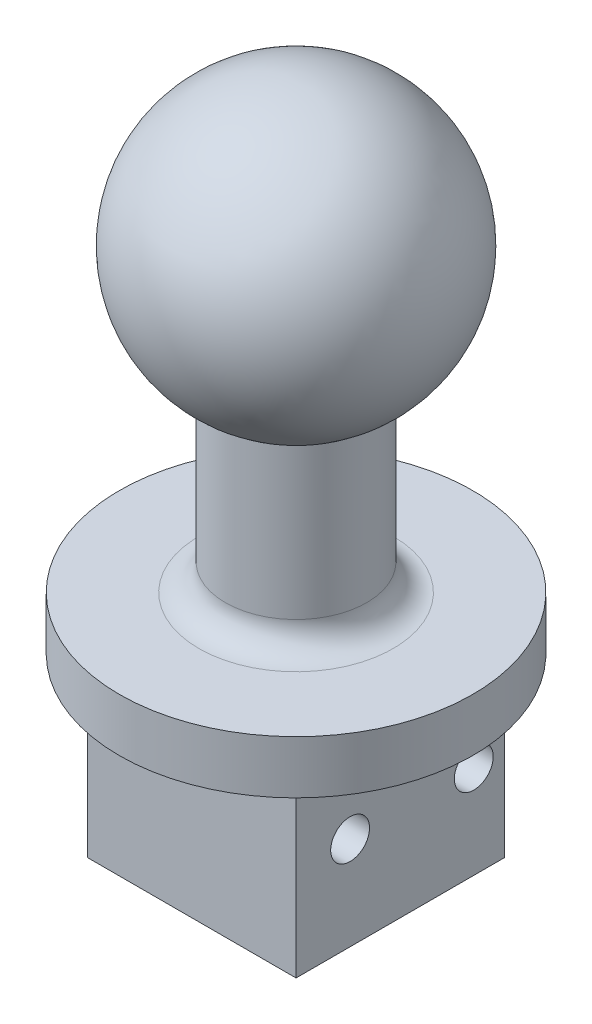
from build123d import *

# Parameters (mm, degrees)
SKETCH1_W           = 11.8
SKETCH1_H           = 11.8
BOSS_EXTRUDE1_DEPTH = 10
SKETCH2_R           = 10
BOSS_EXTRUDE2_DEPTH = 3
SKETCH3_R           = 4
BOSS_EXTRUDE3_DEPTH = 15
FILLET1_R           = 0.5
FILLET2_R           = 1.5
CUT_EXTRUDE1_REACH  = 44.389
SKETCH6_R           = 1.1


with BuildPart() as part:
    # Sketch1 → Boss-Extrude1 (new body)
    with BuildSketch(Plane(origin=(0, 0, 0), x_dir=(1, 0, 0), z_dir=(0, 1, 0))):
        Rectangle(SKETCH1_W, SKETCH1_H)
    extrude(amount=BOSS_EXTRUDE1_DEPTH)

    # Sketch2 → Boss-Extrude2 (add)
    with BuildSketch(Plane(origin=(0, 10, 0), x_dir=(1, 0, 0), z_dir=(0, 1, 0))):
        with Locations(Location((0, 0, 0), (0, 0, 270))):
            Circle(SKETCH2_R)
    extrude(amount=BOSS_EXTRUDE2_DEPTH)

    # Sketch3 → Boss-Extrude3 (add)
    with BuildSketch(Plane(origin=(0, 13, 0), x_dir=(1, 0, 0), z_dir=(0, 1, 0))):
        with Locations(Location((0, 0, 0), (0, 0, 270))):
            Circle(SKETCH3_R)
    extrude(amount=BOSS_EXTRUDE3_DEPTH)

    # Sketch4 → Revolve1 (revolve)
    with BuildSketch(Plane.XY):
        with BuildLine():
            Line((0, 38), (0, 22))
            ThreePointArc((0, 22), (8, 30), (0, 38))
        make_face()
    revolve(axis=Axis((0, 0, 0), (0, 1, 0)))

    # Fillet1
    fillet1_edges = [part.edges().sort_by_distance(p)[0] for p in [
        (-5.9, 10, 0),
        (0, 10, 5.9),
        (5.9, 10, 0),
        (0, 10, -5.9),
    ]]
    fillet(fillet1_edges, radius=FILLET1_R)

    # Fillet2
    fillet2_edges = [part.edges().sort_by_distance(p)[0] for p in [
        (0, 13, -4),
    ]]
    fillet(fillet2_edges, radius=FILLET2_R)

    # Sketch6 → Cut-Extrude1 (cut, up to next)
    with BuildSketch(Plane(origin=(5.9, 0, 0), x_dir=(0, 0, -1), z_dir=(1, 0, 0)), mode=Mode.PRIVATE) as cut_extrude1_sk1:
        with Locations((-2.84, 5.28)):
            Circle(SKETCH6_R)
    cut_extrude1_tool1 = extrude(cut_extrude1_sk1.sketch, amount=-CUT_EXTRUDE1_REACH, mode=Mode.PRIVATE) & part.part
    # Sketch6 → Cut-Extrude1 (cut, up to next)
    with BuildSketch(Plane(origin=(5.9, 0, 0), x_dir=(0, 0, -1), z_dir=(1, 0, 0)), mode=Mode.PRIVATE) as cut_extrude1_sk2:
        with Locations((4.16, 5.28)):
            Circle(SKETCH6_R)
    cut_extrude1_tool2 = extrude(cut_extrude1_sk2.sketch, amount=-CUT_EXTRUDE1_REACH, mode=Mode.PRIVATE) & part.part
    add(cut_extrude1_tool1.solids().sort_by_distance((5.9, 5.28, 2.84))[0], mode=Mode.SUBTRACT)
    add(cut_extrude1_tool2.solids().sort_by_distance((5.9, 5.28, -4.16))[0], mode=Mode.SUBTRACT)


solid = part.part
